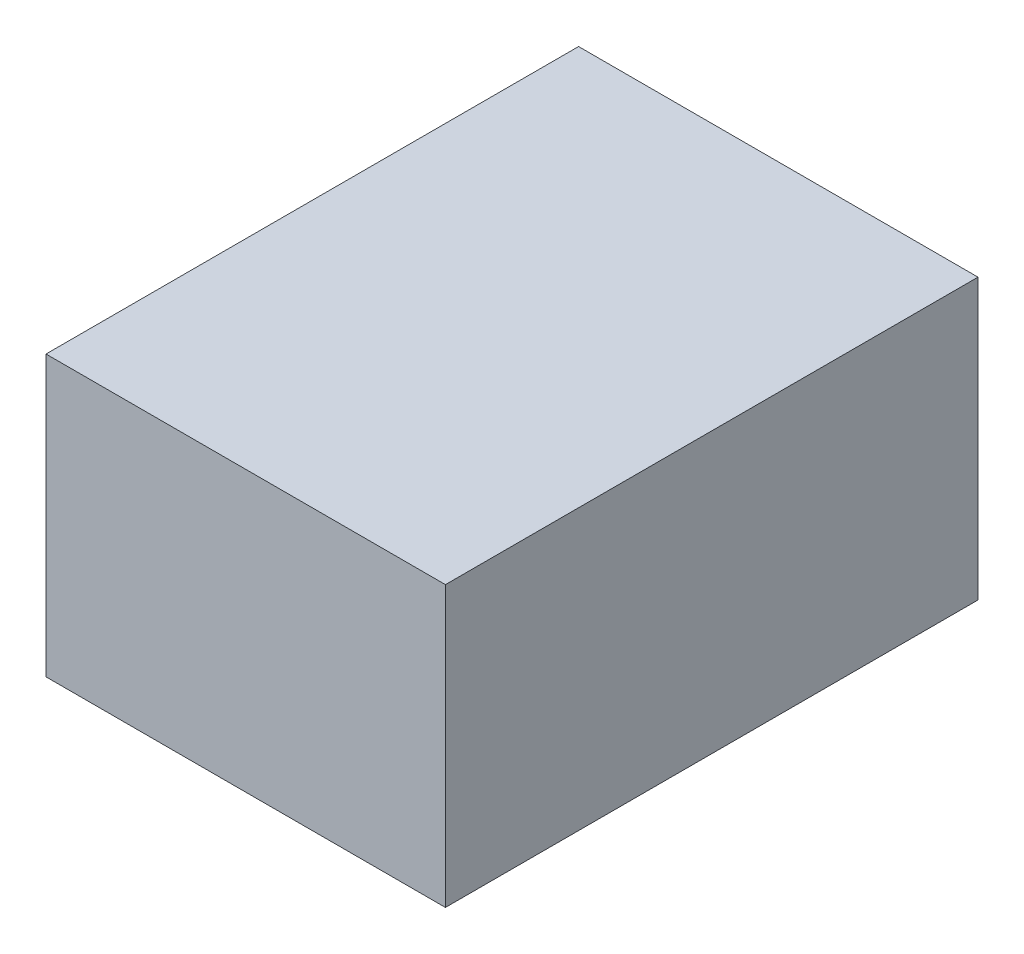
from build123d import *

# Parameters (mm, degrees)
SKETCH1_W           = 7.62
SKETCH1_H           = 5.334
BOSS_EXTRUDE1_DEPTH = 10.16


with BuildPart() as part:
    # Sketch1 → Boss-Extrude1 (new body)
    with BuildSketch(Plane.XY):
        with Locations((0.474610178, 2.568239623)):
            Rectangle(SKETCH1_W, SKETCH1_H)
    extrude(amount=BOSS_EXTRUDE1_DEPTH)


solid = part.part
